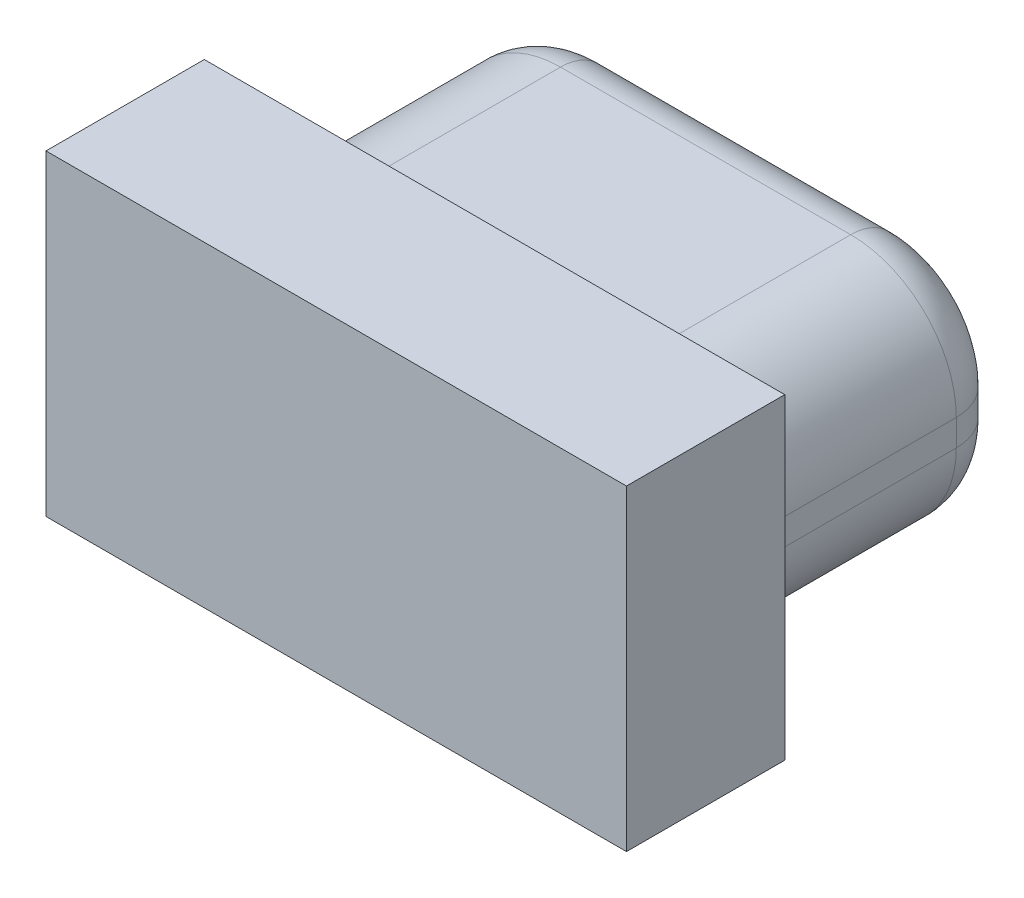
from build123d import *

# Parameters (mm, degrees)
SKETCH1_W           = 9.5
SKETCH1_H           = 4.5
BOSS_EXTRUDE1_DEPTH = 5
SKETCH2_W           = 11
SKETCH2_H           = 6
BOSS_EXTRUDE2_DEPTH = 3
FILLET1_R           = 2
FILLET2_R           = 1


with BuildPart() as part:
    # Sketch1 → Boss-Extrude1 (new body)
    with BuildSketch(Plane.XY):
        with Locations((4.75, 2.25)):
            Rectangle(SKETCH1_W, SKETCH1_H)
    extrude(amount=BOSS_EXTRUDE1_DEPTH)

    # Sketch2 → Boss-Extrude2 (add)
    with BuildSketch(Plane.XY.offset(5)):
        with Locations((4.75, 2.25)):
            Rectangle(SKETCH2_W, SKETCH2_H)
    extrude(amount=BOSS_EXTRUDE2_DEPTH)

    # Fillet1
    fillet1_edges = [part.edges().sort_by_distance(p)[0] for p in [
        (0, 4.5, 2.5),
        (9.5, 4.5, 2.5),
        (9.5, 0, 2.5),
        (0, 0, 2.5),
    ]]
    fillet(fillet1_edges, radius=FILLET1_R)

    # Fillet2
    fillet2_edges = [part.edges().sort_by_distance(p)[0] for p in [
        (0, 2.25, 0),
        (4.75, 4.5, 0),
        (9.5, 2.25, 0),
        (4.75, 0, 0),
        (0.585786438, 0.585786438, 0),
        (8.914213562, 0.585786438, 0),
        (8.914213562, 3.914213562, 0),
        (0.585786438, 3.914213562, 0),
    ]]
    fillet(fillet2_edges, radius=FILLET2_R)


solid = part.part
